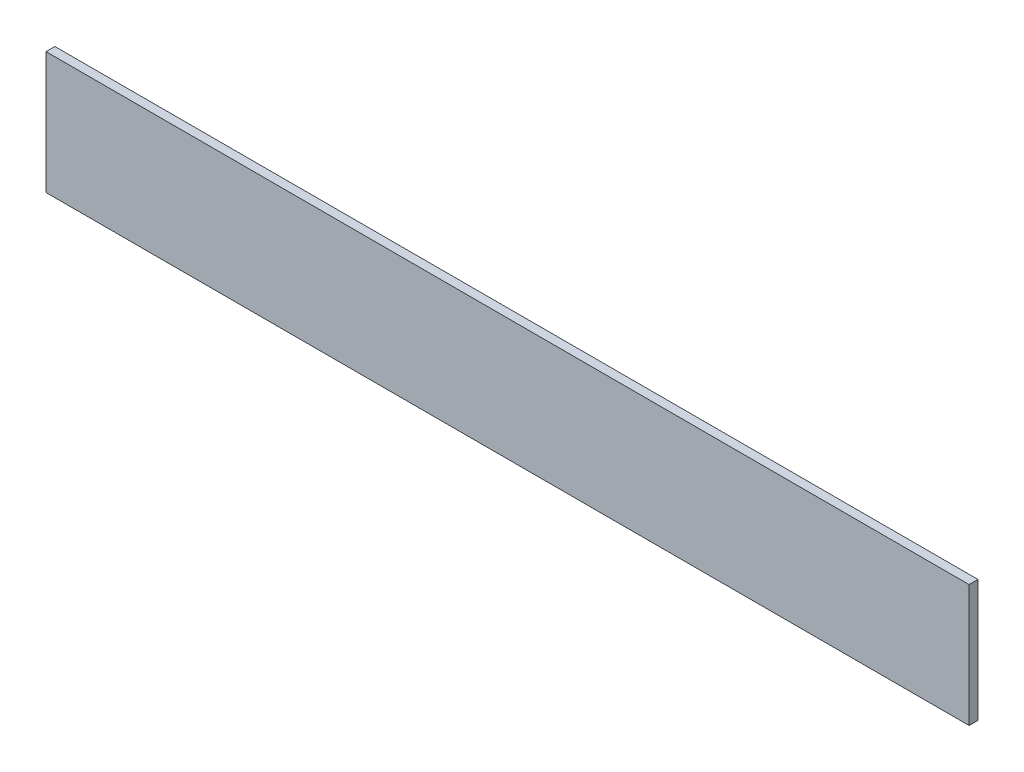
from build123d import *

# Parameters (mm, degrees)
SKETCH_1_W      = 416
SKETCH_1_H      = 55
EXTRUDE_1_DEPTH = 4


with BuildPart() as part:
    # Эскиз1 → Бобышка-Вытянуть1 (new body)
    with BuildSketch(Plane.XY):
        Rectangle(SKETCH_1_W, SKETCH_1_H)
    extrude(amount=EXTRUDE_1_DEPTH)


solid = part.part
